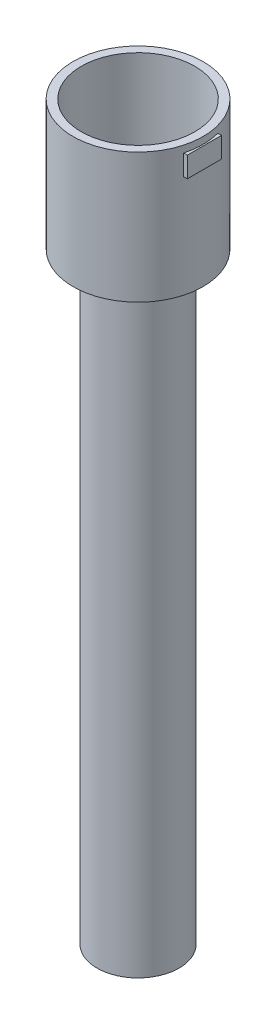
from build123d import *

# Parameters (mm, degrees)
SKETCH_3_W          = 19.4
SKETCH_3_H          = 3
OUTPUT_KEY_DEPTH    = 5
D16_CLEARANCE_START = -18
SKETCH_4_R          = 8.3
D16_CLEARANCE_DEPTH = 18


with BuildPart() as part:
    # 草图1 → Stepped_output_tube (revolve)
    with BuildSketch(Plane.XY, mode=Mode.PRIVATE) as stepped_output_tube_sk:
        Polygon((0, 0), (6, 0), (6, 88), (9.5, 88), (9.5, 107), (8.3, 107), (8.3, 89), (0, 89), align=None)
    revolve(stepped_output_tube_sk.sketch.rotate(Axis((0, 0, 0), (0, 1, 0)), 90), axis=Axis((0, 0, 0), (0, 1, 0)))

    # 草图3 → Output_key (add)
    with BuildSketch(Plane.XY.offset(-2.5)):
        with Locations((0, 104.5)):
            Rectangle(SKETCH_3_W, SKETCH_3_H)
    extrude(amount=OUTPUT_KEY_DEPTH)

    # 草图4 → D16_clearance (cut)
    with BuildSketch(Plane(origin=(0, 107, 0), x_dir=(1, 0, 0), z_dir=(0, 1, 0)).offset(D16_CLEARANCE_START)):
        with Locations(Location((0, 0, 0), (0, 0, 90))):
            Circle(SKETCH_4_R)
    extrude(amount=D16_CLEARANCE_DEPTH, mode=Mode.SUBTRACT)


solid = part.part
